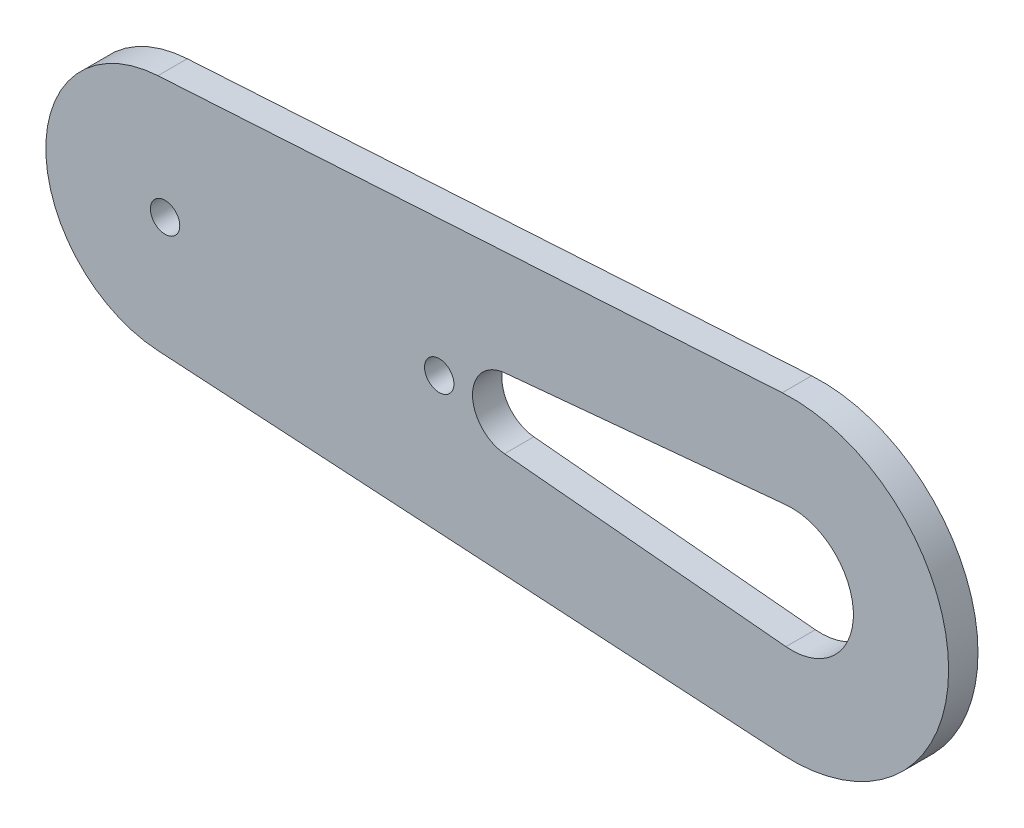
from build123d import *

# Parameters (mm, degrees)
BOSS_EXTRUDE1_DEPTH = 3
SKETCH2_R           = 1.5
CUT_EXTRUDE1_DEPTH  = 3
CUT_EXTRUDE2_DEPTH  = 3


with BuildPart() as part:
    # Sketch1 → Boss-Extrude1 (new body)
    with BuildSketch(Plane.XY):
        with BuildLine():
            Line((-52.51020312, -2.31327399), (47.128491464, 3.68672601))
            ThreePointArc((47.128491464, 3.68672601), (64.120955569, -12.31327399), (47.128491464, -28.31327399))
            Line((47.128491464, -28.31327399), (-52.51020312, -22.31327399))
            ThreePointArc((-52.51020312, -22.31327399), (-61.926141798, -12.31327399), (-52.51020312, -2.31327399))
        make_face()
    extrude(amount=BOSS_EXTRUDE1_DEPTH)

    # Sketch2 → Cut-Extrude1 (cut)
    with BuildSketch(Plane.XY.offset(3)):
        with Locations((12.091972574, -12.31327399)):
            Circle(SKETCH2_R)
        with Locations((-15.908027426, -12.31327399)):
            Circle(SKETCH2_R)
        with Locations((-51.908027426, -12.31327399)):
            Circle(SKETCH2_R)
        with BuildLine():
            Line((18.75680016, -8.728910804), (47.50542085, -6.040638414))
            ThreePointArc((47.50542085, -6.040638414), (54.391972574, -12.31327399), (47.50542085, -18.585909567))
            Line((47.50542085, -18.585909567), (18.75680016, -15.897637177))
            ThreePointArc((18.75680016, -15.897637177), (15.491972574, -12.31327399), (18.75680016, -8.728910804))
        make_face()
    extrude(amount=-CUT_EXTRUDE1_DEPTH, mode=Mode.SUBTRACT)

    # Sketch3 → Cut-Extrude2 (cut)
    with BuildSketch(Plane(origin=(0, 0, 0), x_dir=(-1, 0, 0), z_dir=(0, 0, -1))):
        with BuildLine():
            Line((16.640273069, -0.15327399), (68.701590892, -0.15327399))
            Line((68.701590892, -0.15327399), (68.701590892, -19.932639697))
            Line((68.701590892, -19.932639697), (68.701590892, -24.47327399))
            Line((68.701590892, -24.47327399), (16.640273069, -24.47327399))
            ThreePointArc((16.640273069, -24.47327399), (28.090054502, -12.31327399), (16.640273069, -0.15327399))
        make_face()
    extrude(amount=-CUT_EXTRUDE2_DEPTH, mode=Mode.SUBTRACT)


solid = part.part
